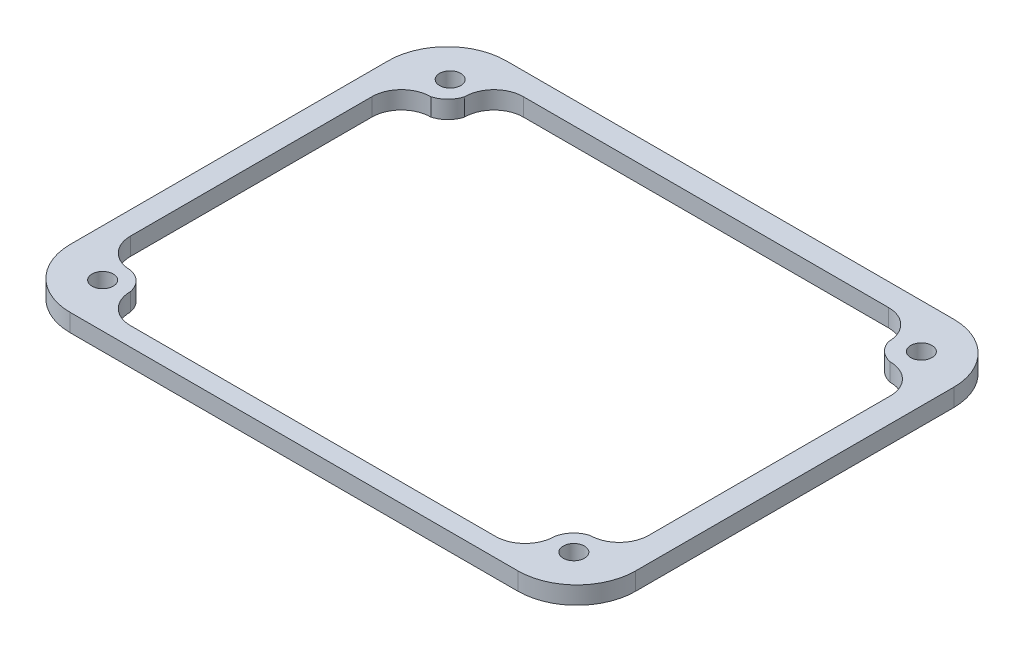
from build123d import *

# Parameters (mm, degrees)
IZIM1_R                     = 1.8
Y_KSEKLIK_EKSTR_ZYON1_DEPTH = 3


with BuildPart() as part:
    # Çizim1 → Yükseklik-Ekstrüzyon1 (new body)
    with BuildSketch(Plane(origin=(0, 0, 0), x_dir=(1, 0, 0), z_dir=(0, 1, 0))):
        with BuildLine():
            Line((-37.887405356, 37.169798919), (38.112594644, 37.169798919))
            ThreePointArc((38.112594644, 37.169798919), (45.183662456, 34.240866731), (48.112594644, 27.169798919))
            Line((48.112594644, 27.169798919), (48.112594644, -26.830201081))
            ThreePointArc((48.112594644, -26.830201081), (45.183662456, -33.901268893), (38.112594644, -36.830201081))
            Line((38.112594644, -36.830201081), (-37.887405356, -36.830201081))
            ThreePointArc((-37.887405356, -36.830201081), (-44.958473168, -33.901268893), (-47.887405356, -26.830201081))
            Line((-47.887405356, -26.830201081), (-47.887405356, 27.169798919))
            ThreePointArc((-47.887405356, 27.169798919), (-44.958473168, 34.240866731), (-37.887405356, 37.169798919))
        make_face()
        with Locations(Location((-39.887405356, 29.669798919, 0), (0, 0, 270))):
            Circle(IZIM1_R, mode=Mode.SUBTRACT)
        with Locations(Location((40.112594644, 29.669798919, 0), (0, 0, 270))):
            Circle(IZIM1_R, mode=Mode.SUBTRACT)
        with Locations(Location((-39.887405356, -29.330201081, 0), (0, 0, 270))):
            Circle(IZIM1_R, mode=Mode.SUBTRACT)
        with Locations(Location((40.112594644, -29.330201081, 0), (0, 0, 270))):
            Circle(IZIM1_R, mode=Mode.SUBTRACT)
        with BuildLine():
            Line((-44, 20.5), (-44, -20.5))
            ThreePointArc((-44, -20.5), (-42.535533906, -24.035533906), (-39, -25.5))
            ThreePointArc((-39, -25.5), (-36.935561042, -26.597935324), (-35.837625718, -28.662374282))
            ThreePointArc((-35.837625718, -28.662374282), (-34.373159624, -32.197908188), (-30.837625718, -33.662374282))
            Line((-30.837625718, -33.662374282), (31.162374282, -33.662374282))
            ThreePointArc((31.162374282, -33.662374282), (34.697908188, -32.197908188), (36.162374282, -28.662374282))
            ThreePointArc((36.162374282, -28.662374282), (37.138980167, -26.684391009), (39, -25.5))
            ThreePointArc((39, -25.5), (42.535533906, -24.035533906), (44, -20.5))
            Line((44, -20.5), (44, 20.5))
            ThreePointArc((44, 20.5), (42.535533906, 24.035533906), (39, 25.5))
            ThreePointArc((39, 25.5), (37.03578822, 26.490091983), (35.866325447, 28.353091412))
            ThreePointArc((35.866325447, 28.353091412), (34.401859353, 31.888625318), (30.866325447, 33.353091412))
            Line((30.866325447, 33.353091412), (-31.133674553, 33.353091412))
            ThreePointArc((-31.133674553, 33.353091412), (-34.677536648, 31.880277464), (-36.133618935, 28.329507991))
            ThreePointArc((-36.133618935, 28.329507991), (-37.197839579, 26.540975831), (-39, 25.5))
            ThreePointArc((-39, 25.5), (-42.535533906, 24.035533906), (-44, 20.5))
        make_face(mode=Mode.SUBTRACT)
    extrude(amount=Y_KSEKLIK_EKSTR_ZYON1_DEPTH)


solid = part.part
